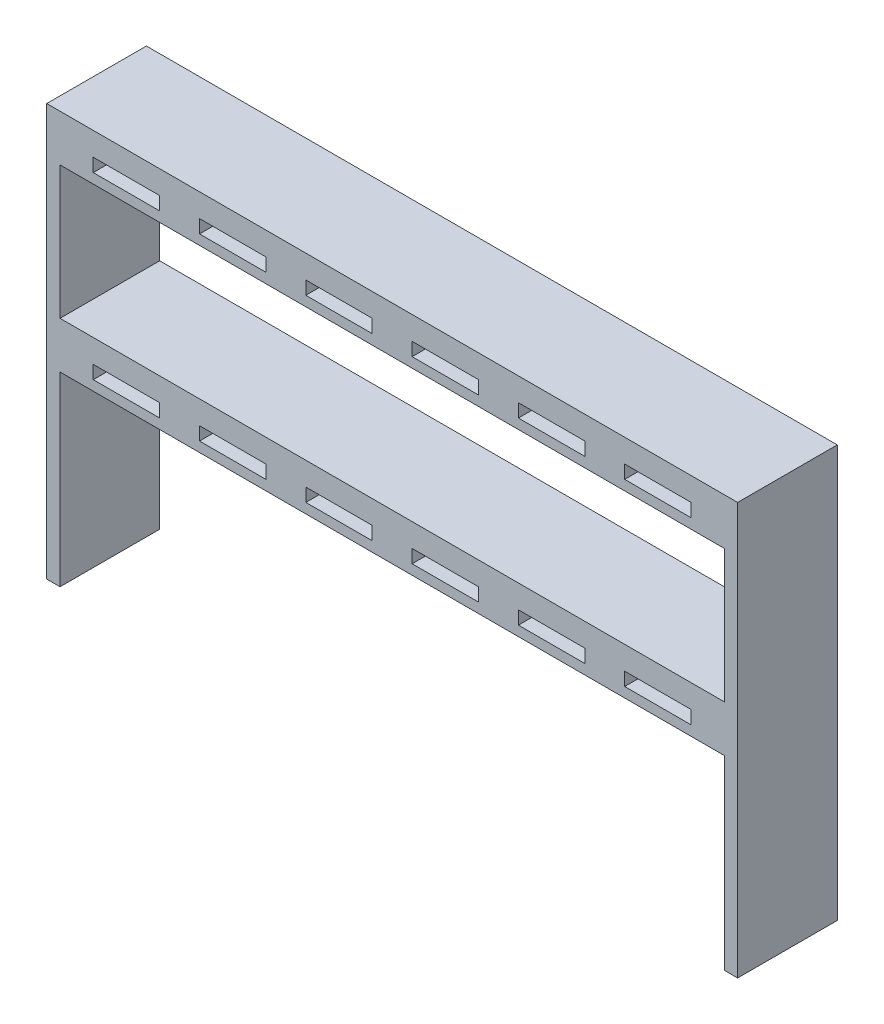
from build123d import *

# Parameters (mm, degrees)
SKETCH1_W           = 100
SKETCH1_H           = 25
BOSS_EXTRUDE1_DEPTH = 15
SKETCH2_W           = 100
SKETCH2_H           = 5
SKETCH2_W_2         = 10
SKETCH2_H_2         = 2
BOSS_EXTRUDE2_DEPTH = 2


with BuildPart() as part:
    # Sketch1 → Boss-Extrude1 (new body)
    with BuildSketch(Plane.XY):
        Polygon((0, 0), (0, 33), (100, 33), (100, 0), (102, 0), (102, 62), (-2, 62), (-2, 0), align=None)
        with Locations((50, 47.5)):
            Rectangle(SKETCH1_W, SKETCH1_H, mode=Mode.SUBTRACT)
    extrude(amount=BOSS_EXTRUDE1_DEPTH)

    # Sketch2 → Boss-Extrude2 (add)
    # profile 1 of 2: a face of its own
    with BuildSketch(Plane(origin=(0, 0, 15), x_dir=(-1, 0, 0), z_dir=(0, 0, -1))):
        with Locations((-50, 57.5)):
            Rectangle(SKETCH2_W, SKETCH2_H)
        with Locations((-74, 57.5)):
            Rectangle(SKETCH2_W_2, SKETCH2_H_2, mode=Mode.SUBTRACT)
        with Locations((-90, 57.5)):
            Rectangle(SKETCH2_W_2, SKETCH2_H_2, mode=Mode.SUBTRACT)
        with Locations((-58, 57.5)):
            Rectangle(SKETCH2_W_2, SKETCH2_H_2, mode=Mode.SUBTRACT)
        with Locations((-42, 57.5)):
            Rectangle(SKETCH2_W_2, SKETCH2_H_2, mode=Mode.SUBTRACT)
        with Locations((-26, 57.5)):
            Rectangle(SKETCH2_W_2, SKETCH2_H_2, mode=Mode.SUBTRACT)
        with Locations((-10, 57.5)):
            Rectangle(SKETCH2_W_2, SKETCH2_H_2, mode=Mode.SUBTRACT)
    # profile 2 of 2: a face of its own
    with BuildSketch(Plane(origin=(0, 0, 15), x_dir=(-1, 0, 0), z_dir=(0, 0, -1))):
        with Locations((-50, 30.5)):
            Rectangle(SKETCH2_W, SKETCH2_H)
        with Locations((-74, 30.5)):
            Rectangle(SKETCH2_W_2, SKETCH2_H_2, mode=Mode.SUBTRACT)
        with Locations((-90, 30.5)):
            Rectangle(SKETCH2_W_2, SKETCH2_H_2, mode=Mode.SUBTRACT)
        with Locations((-58, 30.5)):
            Rectangle(SKETCH2_W_2, SKETCH2_H_2, mode=Mode.SUBTRACT)
        with Locations((-42, 30.5)):
            Rectangle(SKETCH2_W_2, SKETCH2_H_2, mode=Mode.SUBTRACT)
        with Locations((-26, 30.5)):
            Rectangle(SKETCH2_W_2, SKETCH2_H_2, mode=Mode.SUBTRACT)
        with Locations((-10, 30.5)):
            Rectangle(SKETCH2_W_2, SKETCH2_H_2, mode=Mode.SUBTRACT)
    extrude(amount=BOSS_EXTRUDE2_DEPTH)


solid = part.part
